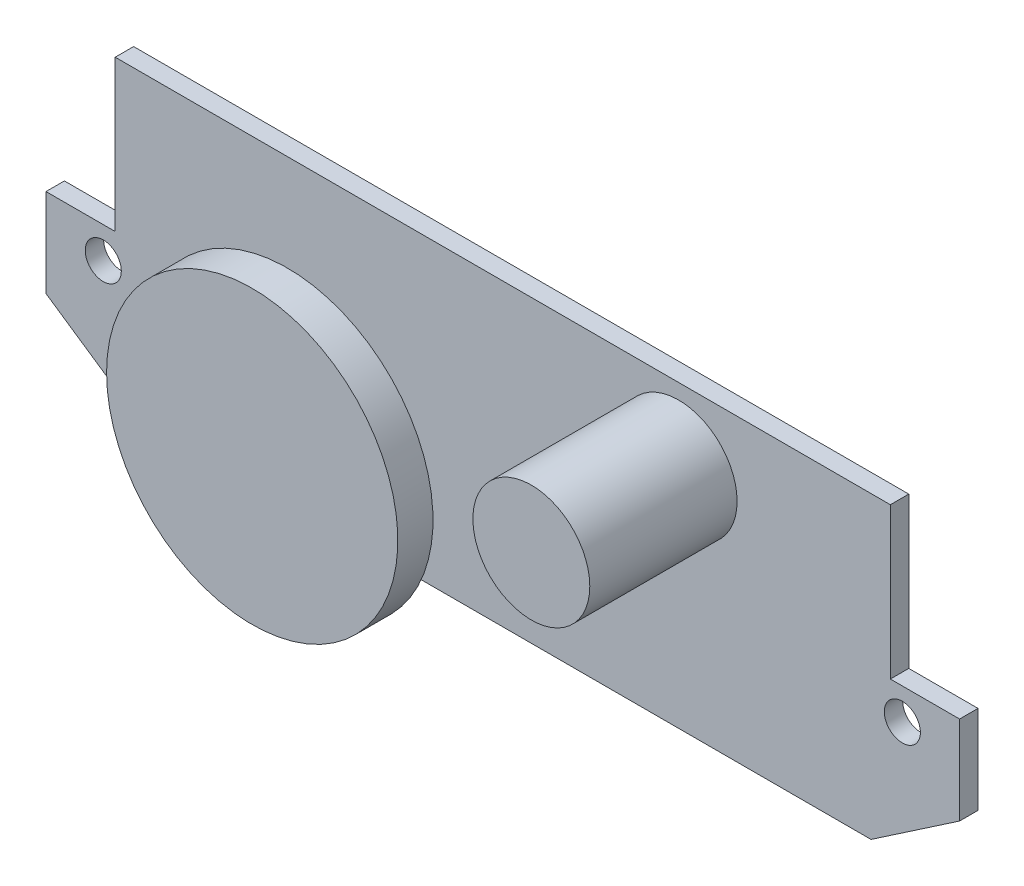
from build123d import *

# Parameters (mm, degrees)
BOSS_EXTRUDE1_DEPTH = 1
CUT_EXTRUDE1_REACH  = 31.686
SKETCH5_R           = 0.98
SKETCH2_R           = 3.175
BOSS_EXTRUDE2_DEPTH = 8
BOSS_EXTRUDE3_START = 1.65
SKETCH3_R           = 7.91
BOSS_EXTRUDE3_DEPTH = 1.91
BOSS_EXTRUDE4_REACH = 34.501
SKETCH4_R           = 5


with BuildPart() as part:
    # Sketch1 → Boss-Extrude1 (new body)
    with BuildSketch(Plane.XY):
        Polygon((21.05, -8.2), (21.05, 0), (0, 0), (0, -16.27), (20, -16.27), (24.81, -13), (24.81, -8.2), align=None)
        Polygon((0, -16.27), (0, 0), (-21.05, 0), (-21.05, -8.2), (-24.81, -8.2), (-24.81, -13), (-20, -16.27), align=None)
    extrude(amount=BOSS_EXTRUDE1_DEPTH)

    # Sketch5 → Cut-Extrude1 (cut, up to next)
    with BuildSketch(Plane.XY.offset(1), mode=Mode.PRIVATE) as cut_extrude1_sk1:
        with Locations((-21.7, -9.9)):
            Circle(SKETCH5_R)
    cut_extrude1_tool1 = extrude(cut_extrude1_sk1.sketch, amount=-CUT_EXTRUDE1_REACH, mode=Mode.PRIVATE) & part.part
    # Sketch5 → Cut-Extrude1 (cut, up to next)
    with BuildSketch(Plane.XY.offset(1), mode=Mode.PRIVATE) as cut_extrude1_sk2:
        with Locations((21.7, -9.9)):
            Circle(SKETCH5_R)
    cut_extrude1_tool2 = extrude(cut_extrude1_sk2.sketch, amount=-CUT_EXTRUDE1_REACH, mode=Mode.PRIVATE) & part.part
    add(cut_extrude1_tool1.solids().sort_by_distance((-21.7, -9.9, 1))[0], mode=Mode.SUBTRACT)
    add(cut_extrude1_tool2.solids().sort_by_distance((21.7, -9.9, 1))[0], mode=Mode.SUBTRACT)

    # Sketch2 → Boss-Extrude2 (add)
    with BuildSketch(Plane.XY.offset(1)):
        with Locations((9.55, -4)):
            Circle(SKETCH2_R)
    extrude(amount=BOSS_EXTRUDE2_DEPTH)


with BuildPart() as body_2:
    # Sketch3 → Boss-Extrude3 (new body)
    with BuildSketch(Plane.XY.offset(1).offset(BOSS_EXTRUDE3_START)):
        with Locations(Location((-10.05, -11.5, 0), (0, 0, 180))):
            Circle(SKETCH3_R)
    extrude(amount=BOSS_EXTRUDE3_DEPTH)

    # Sketch4 → Boss-Extrude4 (add, up to next)
    with BuildSketch(Plane.XY.offset(1), mode=Mode.PRIVATE) as boss_extrude4_sk1:
        with Locations(Location((-10.05, -11.5, 0), (0, 0, 252.554012294))):
            Circle(SKETCH4_R)
    boss_extrude4_tool1 = extrude(boss_extrude4_sk1.sketch, amount=BOSS_EXTRUDE4_REACH, mode=Mode.PRIVATE) - body_2.part

    add(part.part)  # Boss-Extrude4 merges part
    add(boss_extrude4_tool1.solids().sort_by_distance((-10.05, -11.5, 1))[0])


solid = body_2.part
